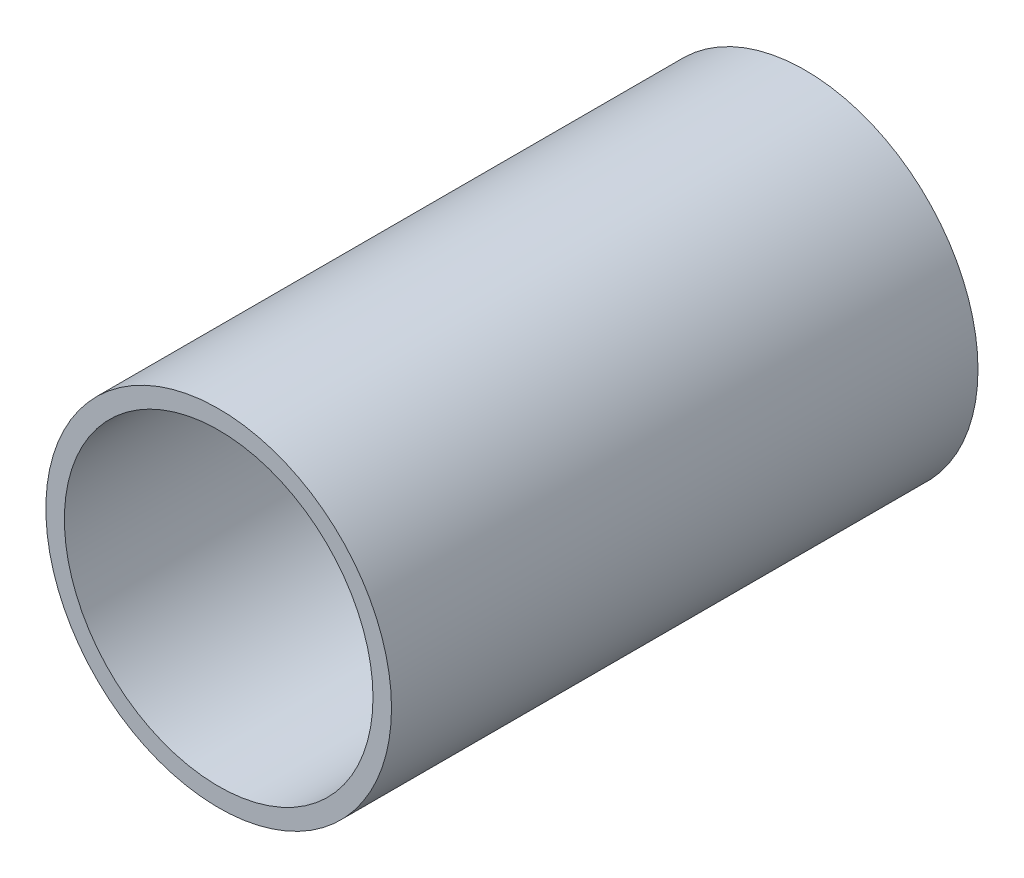
from build123d import *

# Parameters (mm, degrees)
ESQUISSE1_R             = 27.994344018
BOSS_EXTRU_1_DEPTH      = 95
ESQUISSE2_R             = 24.994344018
ENL_V_MAT_EXTRU_1_DEPTH = 80


with BuildPart() as part:
    # Esquisse1 → Boss.-Extru.1 (new body)
    with BuildSketch(Plane.XY):
        Circle(ESQUISSE1_R)
    extrude(amount=BOSS_EXTRU_1_DEPTH)

    # Esquisse2 → Enlèv. mat.-Extru.1 (cut)
    with BuildSketch(Plane.XY.offset(95)):
        Circle(ESQUISSE2_R)
    extrude(amount=-ENL_V_MAT_EXTRU_1_DEPTH, mode=Mode.SUBTRACT)


solid = part.part
